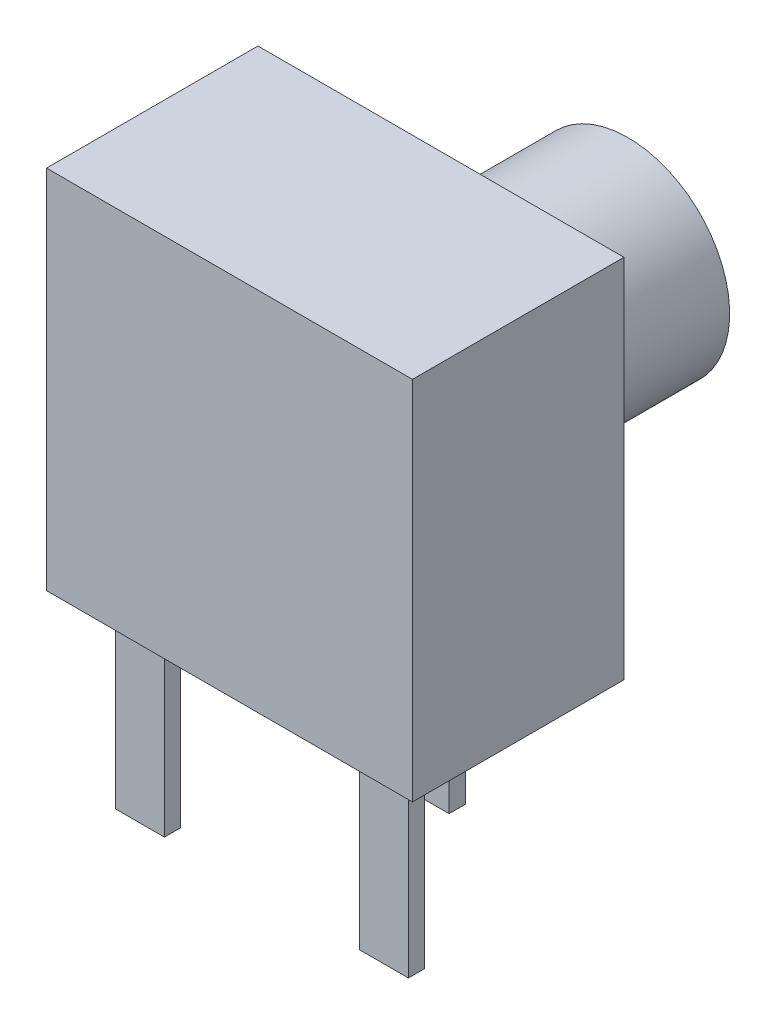
from build123d import *

# Parameters (mm, degrees)
SKETCH_1_W      = 4.5
SKETCH_1_H      = 4.5
EXTRUDE_1_DEPTH = 2.6
SKETCH_3_R      = 1.25
EXTRUDE_2_DEPTH = 2.3
SKETCH_4_W      = 0.6
SKETCH_4_H      = 0.2
EXTRUDE_3_DEPTH = 2.3


with BuildPart() as part:
    # 草图1 → 凸台-拉伸1 (new body)
    with BuildSketch(Plane.XY):
        Rectangle(SKETCH_1_W, SKETCH_1_H)
    extrude(amount=EXTRUDE_1_DEPTH)

    # 草图3 → 凸台-拉伸2 (add)
    with BuildSketch(Plane(origin=(0, 0, 0), x_dir=(-1, 0, 0), z_dir=(0, 0, -1))):
        Circle(SKETCH_3_R)
    extrude(amount=EXTRUDE_2_DEPTH)

    # 草图4 → 凸台-拉伸3 (add)
    with BuildSketch(Plane.XZ.offset(2.25)):
        with Locations((0, 0.1)):
            Rectangle(SKETCH_4_W, SKETCH_4_H)
        with Locations((1.5, 2.1)):
            Rectangle(SKETCH_4_W, SKETCH_4_H)
        with Locations((-1.5, 2.1)):
            Rectangle(SKETCH_4_W, SKETCH_4_H)
    extrude(amount=EXTRUDE_3_DEPTH)


solid = part.part
